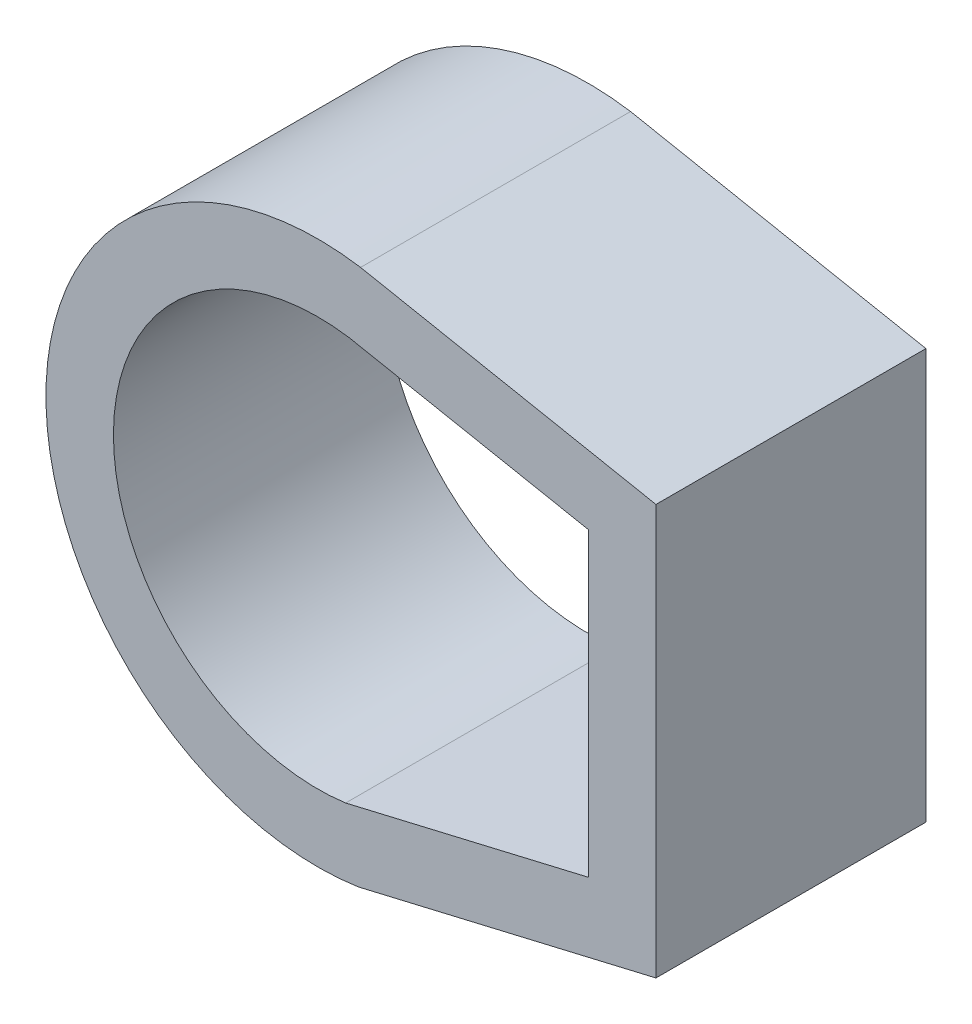
from build123d import *

# Parameters (mm, degrees)
SALIENTE_EXTRUIR1_DEPTH = 20


with BuildPart() as part:
    # Croquis3 → Saliente-Extruir1 (new body)
    with BuildSketch(Plane.XY):
        with BuildLine():
            Line((-4.157247249, 6.116640811), (-26.038869698, 10.382100053))
            ThreePointArc((-26.038869698, 10.382100053), (-49.345509053, -9.429582016), (-26.215773458, -29.447511872))
            Line((-26.215773458, -29.447511872), (-4.157247249, -24.2640649))
            Line((-4.157247249, -24.2640649), (-4.157247249, 6.116640811))
        make_face()
        with BuildLine():
            Line((-9.157247249, 1.997195972), (-26.902985069, 5.456433128))
            ThreePointArc((-26.902985069, 5.456433128), (-44.345215717, -9.396971545), (-27.144674573, -24.529599364))
            Line((-27.144674573, -24.529599364), (-9.157247249, -20.302804028))
            Line((-9.157247249, -20.302804028), (-9.157247249, 1.997195972))
        make_face(mode=Mode.SUBTRACT)
    extrude(amount=SALIENTE_EXTRUIR1_DEPTH)


solid = part.part
